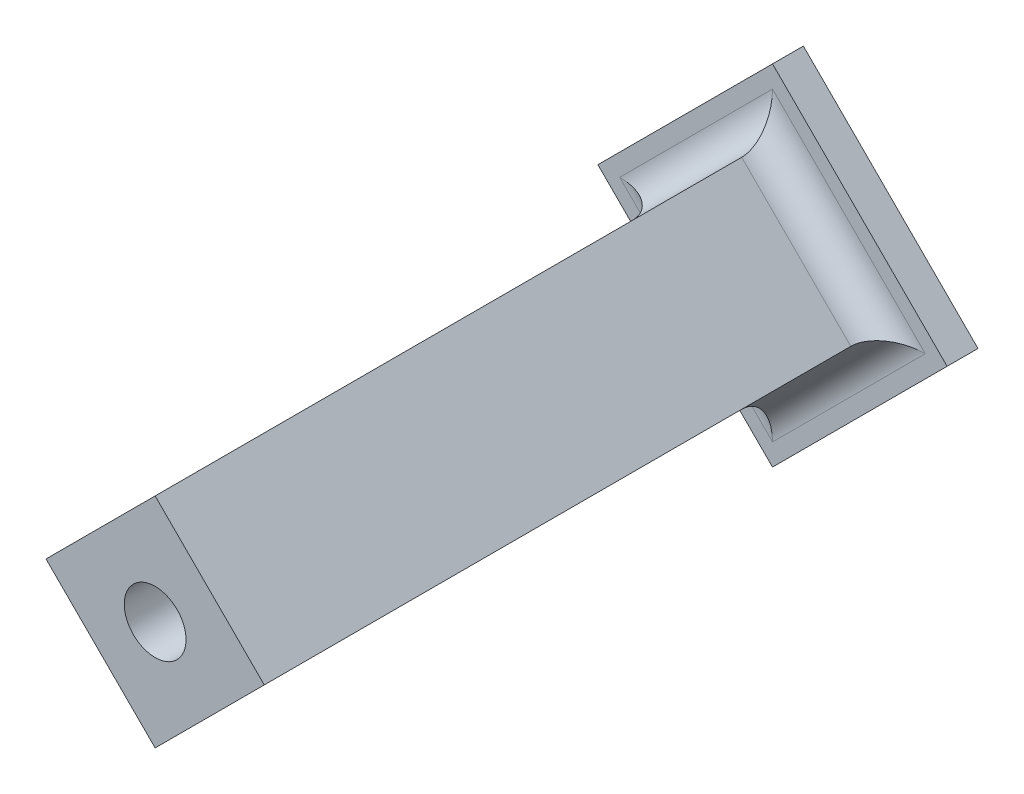
from build123d import *

# Parameters (mm, degrees)
BASE_DEPTH          = 1
BOSS_EXTRUDE2_DEPTH = 20
SKETCH3_R           = 1
CUT_EXTRUDE1_DEPTH  = 23.472205054
FILLET1_R           = 1
SKETCH4_R           = 3
CUT_EXTRUDE2_DEPTH  = 1


with BuildPart() as part:
    # Sketch1 → Base (new body)
    with BuildSketch(Plane.XY):
        Polygon((-5.656854249, 0), (0, 5.656854249), (5.656854249, 0), (0, -5.656854249), align=None)
    extrude(amount=BASE_DEPTH)

    # Sketch2 → Boss-Extrude2 (add)
    with BuildSketch(Plane.XY.offset(1)):
        Polygon((0, -3.535533906), (3.535533906, 0), (0, 3.535533906), (-3.535533906, 0), align=None)
    extrude(amount=BOSS_EXTRUDE2_DEPTH)

    # Sketch3 → Cut-Extrude1 (cut, through all)
    with BuildSketch(Plane.XY.offset(21)):
        Circle(SKETCH3_R)
    extrude(amount=-CUT_EXTRUDE1_DEPTH, mode=Mode.SUBTRACT)

    # Fillet1
    fillet1_edges = [part.edges().sort_by_distance(p)[0] for p in [
        (-1.767766953, -1.767766953, 1),
        (1.767766953, -1.767766953, 1),
        (1.767766953, 1.767766953, 1),
        (-1.767766953, 1.767766953, 1),
    ]]
    fillet(fillet1_edges, radius=FILLET1_R)

    # Sketch4 → Cut-Extrude2 (cut)
    with BuildSketch(Plane(origin=(0, 0, 0), x_dir=(-1, 0, 0), z_dir=(0, 0, -1))):
        Circle(SKETCH4_R)
    extrude(amount=-CUT_EXTRUDE2_DEPTH, mode=Mode.SUBTRACT)


solid = part.part
